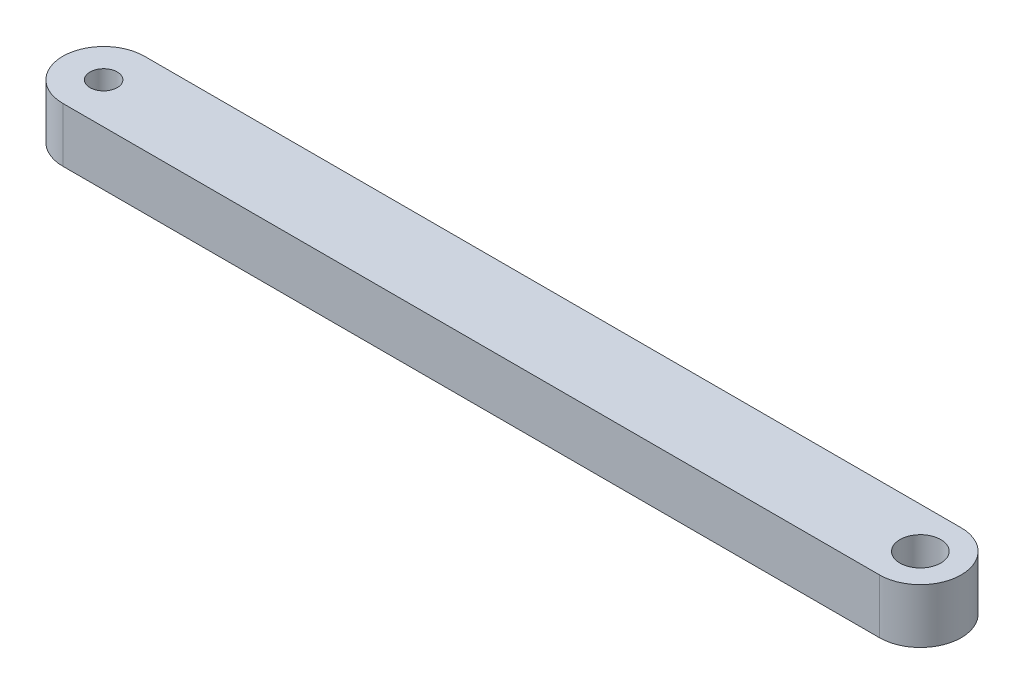
from build123d import *

# Parameters (mm, degrees)
SKETCH_1_R      = 1
SKETCH_1_R_2    = 1.5
EXTRUDE_1_DEPTH = 4


with BuildPart() as part:
    # 草图1 → 凸台-拉伸1 (new body)
    with BuildSketch(Plane(origin=(0, 0, 0), x_dir=(1, 0, 0), z_dir=(0, 1, 0))):
        with BuildLine():
            Line((-30, 3), (30, 3))
            ThreePointArc((30, 3), (33, 0), (30, -3))
            Line((30, -3), (-30, -3))
            ThreePointArc((-30, -3), (-33, 0), (-30, 3))
        make_face()
        with Locations(Location((-30, 0, 0), (0, 0, 270))):
            Circle(SKETCH_1_R, mode=Mode.SUBTRACT)
        with Locations(Location((30, 0, 0), (0, 0, 270))):
            Circle(SKETCH_1_R_2, mode=Mode.SUBTRACT)
    extrude(amount=EXTRUDE_1_DEPTH)


solid = part.part
